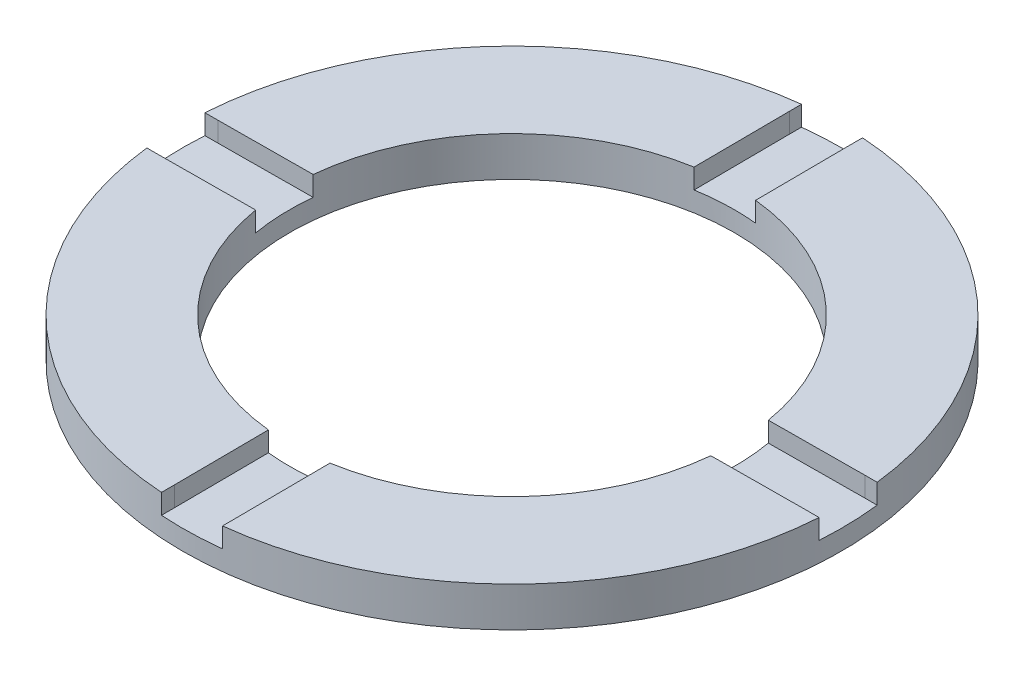
from build123d import *

# Parameters (mm, degrees)
SKETCH1_R           = 83
BOSS_EXTRUDE1_DEPTH = 10
SKETCH3_R           = 56
CUT_EXTRUDE2_DEPTH  = 118.804923496
CUT_EXTRUDE4_START  = -5
CUT_EXTRUDE4_DEPTH  = 5


with BuildPart() as part:
    # Sketch1 → Boss-Extrude1 (new body)
    with BuildSketch(Plane(origin=(0, 0, 0), x_dir=(1, 0, 0), z_dir=(0, 1, 0))):
        with Locations(Location((0, 0, 0), (0, 0, 270))):
            Circle(SKETCH1_R)
    extrude(amount=BOSS_EXTRUDE1_DEPTH)

    # Sketch3 → Cut-Extrude2 (cut, through all)
    with BuildSketch(Plane.XZ):
        with Locations(Location((0, 0, 0), (0, 0, 270))):
            Circle(SKETCH3_R)
    extrude(amount=-CUT_EXTRUDE2_DEPTH, mode=Mode.SUBTRACT)

    # Sketch6 → Cut-Extrude4 (cut)
    with BuildSketch(Plane(origin=(0, 10, 0), x_dir=(1, 0, 0), z_dir=(0, 1, 0)).offset(CUT_EXTRUDE4_START)):
        with BuildLine():
            Line((55.715434798, -5.638290989), (79.539838583, -5.475879047))
            Line((79.539838583, -5.475879047), (82.819168969, -5.475879047))
            ThreePointArc((82.819168969, -5.475879047), (82.975116618, 2.032245607), (82.451795016, 9.523733443))
            Line((82.451795016, 9.523733443), (79.431867066, 9.523733443))
            Line((79.431867066, 9.523733443), (55.212462973, 9.358628767))
            ThreePointArc((55.212462973, 9.358628767), (55.968531574, 1.877091756), (55.715434798, -5.638290989))
        make_face()
        with BuildLine():
            Line((5.638290989, 55.715434798), (5.475879047, 79.539838583))
            Line((5.475879047, 79.539838583), (5.475879047, 82.819168969))
            ThreePointArc((5.475879047, 82.819168969), (-2.032245607, 82.975116618), (-9.523733443, 82.451795016))
            Line((-9.523733443, 82.451795016), (-9.523733443, 79.431867066))
            Line((-9.523733443, 79.431867066), (-9.358628767, 55.212462973))
            ThreePointArc((-9.358628767, 55.212462973), (-1.877091756, 55.968531574), (5.638290989, 55.715434798))
        make_face()
        with BuildLine():
            Line((-79.431867066, -9.523733443), (-55.212462973, -9.358628767))
            ThreePointArc((-55.212462973, -9.358628767), (-55.968531574, -1.877091756), (-55.715434798, 5.638290989))
            Line((-55.715434798, 5.638290989), (-79.539838583, 5.475879047))
            Line((-79.539838583, 5.475879047), (-82.819168969, 5.475879047))
            ThreePointArc((-82.819168969, 5.475879047), (-82.975116618, -2.032245607), (-82.451795016, -9.523733443))
            Line((-82.451795016, -9.523733443), (-79.431867066, -9.523733443))
        make_face()
        with BuildLine():
            Line((9.523733443, -79.431867066), (9.358628767, -55.212462973))
            ThreePointArc((9.358628767, -55.212462973), (1.877091756, -55.968531574), (-5.638290989, -55.715434798))
            Line((-5.638290989, -55.715434798), (-5.475879047, -79.539838583))
            Line((-5.475879047, -79.539838583), (-5.475879047, -82.819168969))
            ThreePointArc((-5.475879047, -82.819168969), (2.032245607, -82.975116618), (9.523733443, -82.451795016))
            Line((9.523733443, -82.451795016), (9.523733443, -79.431867066))
        make_face()
    extrude(amount=CUT_EXTRUDE4_DEPTH, mode=Mode.SUBTRACT)


solid = part.part
